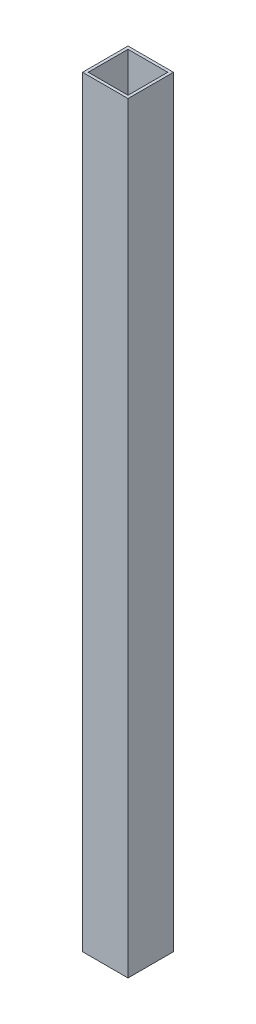
from build123d import *

# Parameters (mm, degrees)
SKETCH1_W           = 50.8
SKETCH1_H           = 50.8
SKETCH1_W_2         = 44.45
SKETCH1_H_2         = 44.45
BOSS_EXTRUDE1_DEPTH = 850.900199367


with BuildPart() as part:
    # Sketch1 → Boss-Extrude1 (new body)
    with BuildSketch(Plane(origin=(0, 0, 0), x_dir=(1, 0, 0), z_dir=(0, 1, 0))):
        Rectangle(SKETCH1_W, SKETCH1_H)
        Rectangle(SKETCH1_W_2, SKETCH1_H_2, mode=Mode.SUBTRACT)
    extrude(amount=BOSS_EXTRUDE1_DEPTH)


solid = part.part
